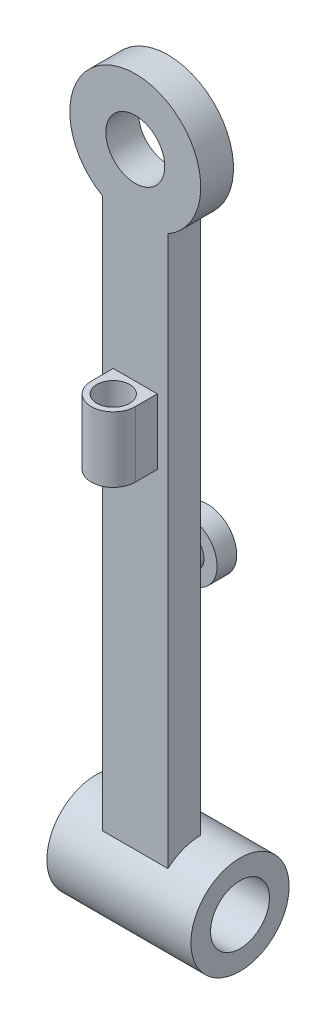
from build123d import *
from build123d.topology import SkipClean

# Parameters (mm, degrees)
BOSS_EXTRUDE1_DEPTH      = 5
BOSS_EXTRUDE2_START      = -5
SKETCH3_R                = 7.5
BOSS_EXTRUDE2_DEPTH      = 11
SKETCH7_R                = 2.5
BOSS_EXTRUDE7_DEPTH      = 3
SKETCH8_R                = 4.5
BOSS_EXTRUDE8_DEPTH      = 3
BOSS_EXTRUDE9_DEPTH      = 8
BOSS_EXTRUDE9_DEPTH_BACK = 2
BOSS_EXTRUDE9_START      = 65
SKETCH9_R                = 2.5
SKETCH4_R                = 4.5
CUT_EXTRUDE1_DEPTH       = 117.364534493


with BuildPart() as part:
    # Sketch1 → Boss-Extrude1 (new body)
    with BuildSketch(Plane.XY):
        with BuildLine():
            Line((-5, 95), (-5, 0))
            Line((-5, 0), (0, 0))
            Line((0, 0), (0, 99.161508865))
            ThreePointArc((0, 99.161508865), (-4.5, 103.661508865), (0, 108.161508865))
            Line((0, 108.161508865), (0, 113.662595596))
            ThreePointArc((0, 113.662595596), (-9.660389154, 106.249677564), (-5, 95))
        make_face()
    boss_extrude1 = extrude(amount=BOSS_EXTRUDE1_DEPTH)

    # Sketch3 → Boss-Extrude2 (add)
    with BuildSketch(Plane.ZY.offset(5).offset(BOSS_EXTRUDE2_START)):
        with Locations(Location((0, 5.43173798, 0), (0, 0, 270))):
            Circle(SKETCH3_R)
    boss_extrude2 = extrude(amount=BOSS_EXTRUDE2_DEPTH)

    # Sketch7 → Boss-Extrude7 (add)
    with BuildSketch(Plane(origin=(0, 0, 0), x_dir=(-1, 0, 0), z_dir=(0, 0, -1))):
        with Locations(Location((0, 46.751317941, 0), (0, 0, 270))):
            Circle(SKETCH7_R)
    extrude(amount=BOSS_EXTRUDE7_DEPTH)

    # Sketch8 → Boss-Extrude8 (add)
    with BuildSketch(Plane(origin=(0, 0, -3), x_dir=(-1, 0, 0), z_dir=(0, 0, -1))):
        with Locations((0, 46.751317941)):
            Circle(SKETCH8_R)
    extrude(amount=BOSS_EXTRUDE8_DEPTH)

    # Sketch9 → Boss-Extrude9 (add, two sides: drawn at the far end of the back side and taken through both)
    with BuildSketch(Plane(origin=(0, 0, 0), x_dir=(1, 0, 0), z_dir=(0, 1, 0)).offset(BOSS_EXTRUDE9_START - BOSS_EXTRUDE9_DEPTH_BACK)):
        with BuildLine():
            Line((-3.3634301, -8.3634301), (-3.3634301, -5))
            Line((-3.3634301, -5), (3.3634301, -5))
            Line((3.3634301, -5), (3.3634301, -8.3634301))
            ThreePointArc((3.3634301, -8.3634301), (0, -11.726860201), (-3.3634301, -8.3634301))
        make_face()
        with Locations(Location((0, -8.3634301, 0), (0, 0, 270))):
            Circle(SKETCH9_R, mode=Mode.SUBTRACT)
    extrude(amount=BOSS_EXTRUDE9_DEPTH + BOSS_EXTRUDE9_DEPTH_BACK)

    # Mirror1: Boss-Extrude1, Boss-Extrude2 across plane
    with SkipClean():  # the faces are left unmerged after this step: merging them gives an invalid solid
        add(boss_extrude1.mirror(Plane(origin=(0, 0, 5), x_dir=(0, 0, 1), z_dir=(-1, 0, 0))))
        add(boss_extrude2.mirror(Plane(origin=(0, 0, 5), x_dir=(0, 0, 1), z_dir=(-1, 0, 0))))

    # Sketch4 → Cut-Extrude1 (cut, through all)
    with SkipClean():  # the faces are left unmerged after this step: merging them gives an invalid solid
        with BuildSketch(Plane.ZY.offset(11)):
            with Locations(Location((0, 5.43173798, 0), (0, 0, 270))):
                Circle(SKETCH4_R)
        extrude(amount=-CUT_EXTRUDE1_DEPTH, mode=Mode.SUBTRACT)


solid = part.part
